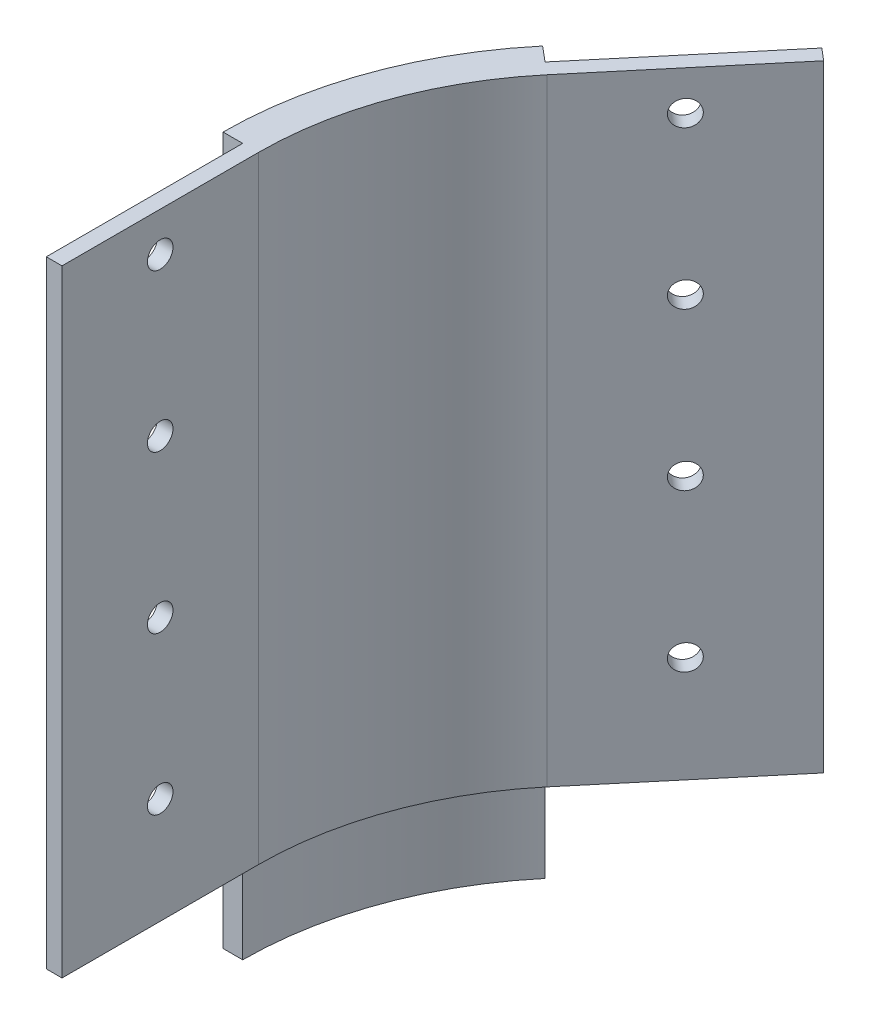
from build123d import *

# Parameters (mm, degrees)
SKETCH1_R           = 2.6
BOSS_EXTRUDE1_DEPTH = 20
BOSS_EXTRUDE2_DEPTH = 180
CUT_EXTRUDE1_DEPTH  = 192.378764777
BOSS_EXTRUDE3_DEPTH = 180
SKETCH5_R           = 3.25
CUT_EXTRUDE2_DEPTH  = 229.212445613
CUT_EXTRUDE3_DEPTH  = 23


with BuildPart() as part:
    # Sketch1 → Boss-Extrude1 (new body)
    with BuildSketch(Plane(origin=(0, 0, 0), x_dir=(1, 0, 0), z_dir=(0, 1, 0))):
        with BuildLine():
            Line((10, 0), (-10, 0))
            ThreePointArc((-10, 0), (-4.705844869, 30.024645745), (10.538067282, 56.427876097))
            Line((10.538067282, 56.427876097), (25.858956145, 43.572123903))
            ThreePointArc((25.858956145, 43.572123903), (14.088007547, 23.184242879), (10, 0))
        make_face()
        with Locations(Location((0.645465629, 10, 0), (0, 0, 270))):
            Circle(SKETCH1_R, mode=Mode.SUBTRACT)
        with Locations(Location((4.691081339, 26.604444312, 0), (0, 0, 270))):
            Circle(SKETCH1_R, mode=Mode.SUBTRACT)
        with Locations(Location((12.265090975, 41.92465826, 0), (0, 0, 270))):
            Circle(SKETCH1_R, mode=Mode.SUBTRACT)
    extrude(amount=BOSS_EXTRUDE1_DEPTH)

    # Sketch3 → Cut-Extrude1 (cut, through all)
    with BuildSketch(Plane(origin=(0, 20, 0), x_dir=(1, 0, 0), z_dir=(0, 1, 0))):
        with BuildLine():
            Line((25.858956145, 43.572123903), (10.538067282, 56.427876097))
            ThreePointArc((10.538067282, 56.427876097), (-4.705844869, 30.024645745), (-10, 0))
            Line((-10, 0), (10, 0))
            ThreePointArc((10, 0), (14.088007547, 23.184242879), (25.858956145, 43.572123903))
        make_face()
    extrude(amount=-CUT_EXTRUDE1_DEPTH, mode=Mode.SUBTRACT)


with BuildPart() as body_2:
    # Sketch2 → Boss-Extrude2 (new body)
    with BuildSketch(Plane(origin=(0, 20, 0), x_dir=(1, 0, 0), z_dir=(0, 1, 0))):
        with BuildLine():
            Line((6.707845067, 59.641814145), (10.538067282, 56.427876097))
            ThreePointArc((10.538067282, 56.427876097), (-4.705844869, 30.024645745), (-10, 0))
            Line((-10, 0), (-15, 0))
            ThreePointArc((-15, 0), (-9.404307973, 31.734746462), (6.707845067, 59.641814145))
        make_face()
    extrude(amount=BOSS_EXTRUDE2_DEPTH)

    # Sketch4 → Boss-Extrude3 (add)
    with BuildSketch(Plane(origin=(0, 200, 0), x_dir=(1, 0, 0), z_dir=(0, 1, 0))):
        with BuildLine():
            ThreePointArc((-0.947074386, 28.656565172), (5.225221154, 41.893095672), (13.602245055, 53.856725658))
            Line((13.602245055, 53.856725658), (45.741625539, 92.158947814))
            Line((45.741625539, 92.158947814), (42.677447766, 94.730098253))
            Line((42.677447766, 94.730098253), (10.538067282, 56.427876097))
            ThreePointArc((10.538067282, 56.427876097), (1.761119538, 43.893095672), (-4.705844869, 30.024645745))
            Line((-4.705844869, 30.024645745), (-0.947074386, 28.656565172))
        make_face()
        with BuildLine():
            ThreePointArc((-6, 0), (-4.727099487, 14.54931944), (-0.947074386, 28.656565172))
            Line((-0.947074386, 28.656565172), (-4.705844869, 30.024645745))
            ThreePointArc((-4.705844869, 30.024645745), (-8.666330499, 15.243912151), (-10, 0))
            Line((-10, 0), (-10, -50))
            Line((-10, -50), (-6, -50))
            Line((-6, -50), (-6, 0))
        make_face()
    extrude(amount=-BOSS_EXTRUDE3_DEPTH)

    # Sketch5 → Cut-Extrude2 (cut, through all)
    with BuildSketch(Plane.ZY.offset(10)):
        with Locations((25, 190)):
            Circle(SKETCH5_R)
        with Locations((25, 150)):
            Circle(SKETCH5_R)
        with Locations((25, 110)):
            Circle(SKETCH5_R)
        with Locations((25, 70)):
            Circle(SKETCH5_R)
        with Locations((25, 30)):
            Circle(SKETCH5_R)
    cut_extrude2 = extrude(amount=-CUT_EXTRUDE2_DEPTH, mode=Mode.SUBTRACT)

    # Mirror1: Cut-Extrude2 across plane
    add(cut_extrude2.mirror(Plane(origin=(9.099255857, 0, -25), x_dir=(0.9396926207859084, 0, 0.3420201433256689), z_dir=(0.3420201433256689, 0, -0.9396926207859084))), mode=Mode.SUBTRACT)

    # Sketch7 → Cut-Extrude3 (cut)
    with BuildSketch(Plane.XZ.offset(-20)):
        with BuildLine():
            Line((10.538067282, -56.427876097), (42.677447766, -94.730098253))
            Line((42.677447766, -94.730098253), (45.741625539, -92.158947814))
            Line((45.741625539, -92.158947814), (13.602245055, -53.856725658))
            ThreePointArc((13.602245055, -53.856725658), (-0.947074386, -28.656565172), (-6, 0))
            Line((-6, 0), (-6, 50))
            Line((-6, 50), (-10, 50))
            Line((-10, 50), (-10, 0))
            ThreePointArc((-10, 0), (-4.705844869, -30.024645745), (10.538067282, -56.427876097))
        make_face()
    extrude(amount=-CUT_EXTRUDE3_DEPTH, mode=Mode.SUBTRACT)


solid = body_2.part
